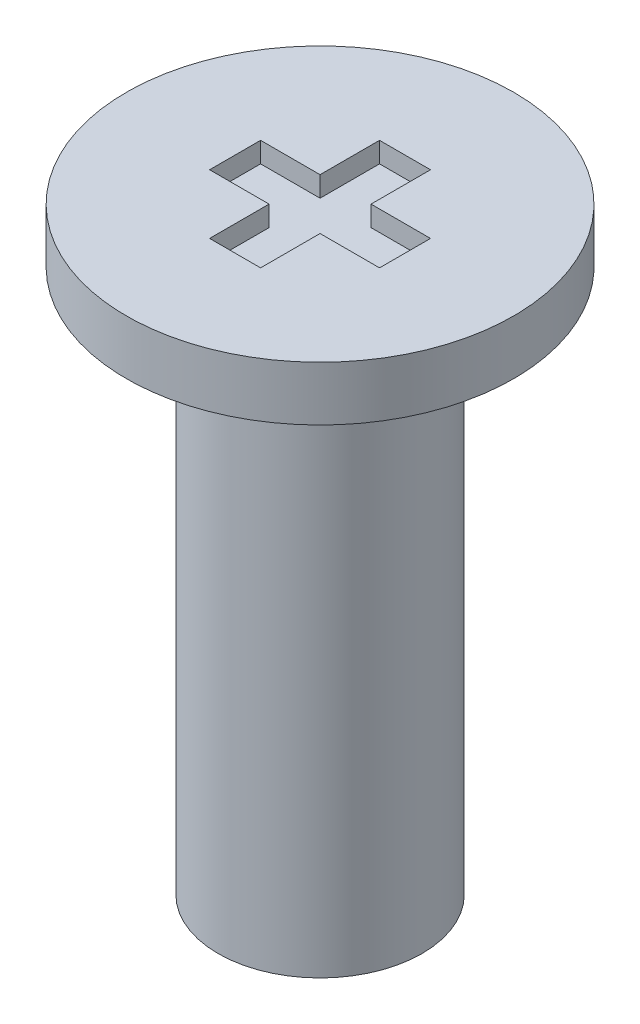
from build123d import *

# Parameters (mm, degrees)
SKETCH_2_W               = 0.75
SKETCH_2_H               = 1.25
CUT_EXTRUDE_1_DEPTH      = 0.3
PATTERN_CIRCULAR_1_COUNT = 4


with BuildPart() as part:
    # ｽｹｯﾁ1 → 回転1 (revolve)
    with BuildSketch(Plane.XY, mode=Mode.PRIVATE) as revolve_1_sk:
        Polygon((0, 0), (2.85, 0), (2.85, -0.8), (1.5, -0.8), (1.5, -8.8), (0, -8.8), align=None)
    revolve(revolve_1_sk.sketch.rotate(Axis((0, -8.8, 0), (0, 1, 0)), 90), axis=Axis((0, -8.8, 0), (0, 1, 0)))

    # ｽｹｯﾁ2 → ｶｯﾄ - 押し出し1 (cut)
    with BuildSketch(Plane(origin=(0, 0, 0), x_dir=(1, 0, 0), z_dir=(0, 1, 0))):
        with Locations((0, 0.625)):
            Rectangle(SKETCH_2_W, SKETCH_2_H)
    cut_extrude_1 = extrude(amount=-CUT_EXTRUDE_1_DEPTH, mode=Mode.SUBTRACT)

    # 円形ﾊﾟﾀｰﾝ1: ｶｯﾄ - 押し出し1 ×4 about axis
    pattern_circular_1_axis = Axis((0, 0, 0), (0, 1, 0))
    for i in range(1, PATTERN_CIRCULAR_1_COUNT):
        add(cut_extrude_1.rotate(pattern_circular_1_axis, i * 360 / PATTERN_CIRCULAR_1_COUNT), mode=Mode.SUBTRACT)


solid = part.part
